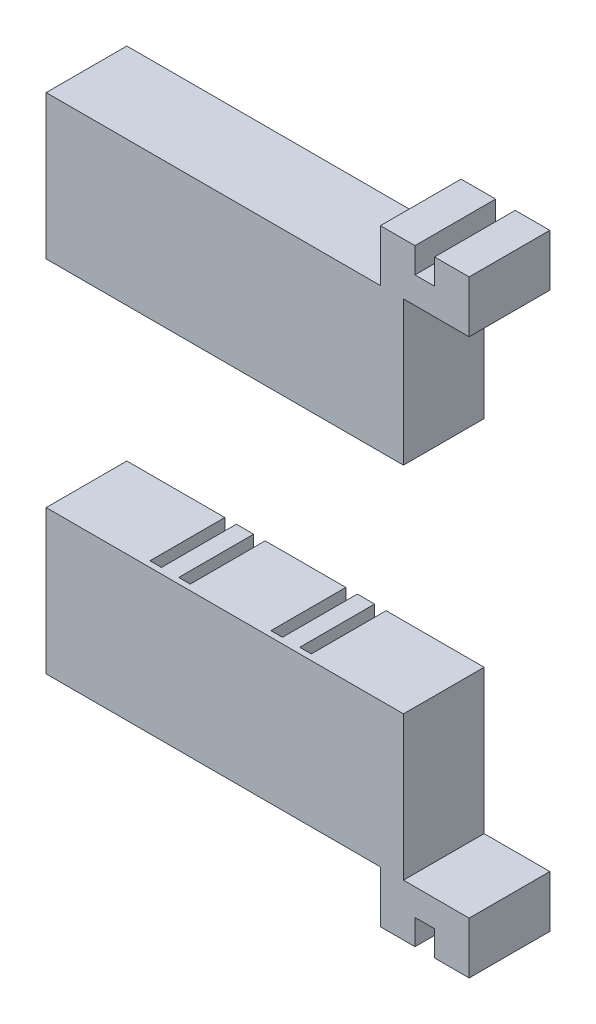
from build123d import *

# Parameters (mm, degrees)
BOSS_EXTRUDE1_DEPTH   = 13
BOSS_EXTRUDE1_2_DEPTH = 13
BOSS_EXTRUDE1_3_DEPTH = 13
BOSS_EXTRUDE1_4_DEPTH = 13
BOSS_EXTRUDE1_5_DEPTH = 13
BOSS_EXTRUDE1_6_DEPTH = 13
BOSS_EXTRUDE3_DEPTH   = 1
CUT_EXTRUDE1_DEPTH    = 1
CUT_EXTRUDE2_DEPTH    = 1


with BuildPart() as part:
    # Sketch1 → Boss-Extrude1 (new body)
    with BuildSketch(Plane.XY):
        with BuildLine():
            Line((0, 0), (58, 0))
            Line((58, 0), (58, 9))
            Line((58, 9), (64, 9))
            Line((64, 9), (64, 4.6))
            Line((64, 4.6), (67.4, 4.6))
            Line((67.4, 4.6), (67.4, 9))
            Line((67.4, 9), (73.4, 9))
            Line((73.4, 9), (73.4, 0))
            Line((73.4, 0), (62, 0))
            Line((62, 0), (62, -25))
            Line((62, -25), (45, -25))
            Line((45, -25), (45, -20))
            ThreePointArc((45, -20), (45.585786438, -18.585786438), (47, -18))
            Line((47, -18), (50, -18))
            ThreePointArc((50, -18), (51.414213562, -17.414213562), (52, -16))
            Line((52, -16), (52, -12))
            ThreePointArc((52, -12), (51.414213562, -10.585786438), (50, -10))
            Line((50, -10), (40, -10))
            ThreePointArc((40, -10), (38.585786438, -10.585786438), (38, -12))
            Line((38, -12), (38, -25))
            Line((38, -25), (24, -25))
            Line((24, -25), (24, -12))
            ThreePointArc((24, -12), (23.414213562, -10.585786438), (22, -10))
            Line((22, -10), (12, -10))
            ThreePointArc((12, -10), (10.585786438, -10.585786438), (10, -12))
            Line((10, -12), (10, -16))
            ThreePointArc((10, -16), (10.585786438, -17.414213562), (12, -18))
            Line((12, -18), (15, -18))
            ThreePointArc((15, -18), (16.414213562, -18.585786438), (17, -20))
            Line((17, -20), (17, -25))
            Line((17, -25), (0, -25))
            Line((0, -25), (0, 0))
        make_face()
    extrude(amount=BOSS_EXTRUDE1_DEPTH)



with BuildPart() as body_2:
    # Sketch1 → Boss-Extrude1 2 (new body)
    with BuildSketch(Plane.XY):
        with BuildLine():
            Line((40, -25), (40, -13))
            ThreePointArc((40, -13), (40.292893219, -12.292893219), (41, -12))
            Line((41, -12), (49, -12))
            ThreePointArc((49, -12), (49.707106781, -12.292893219), (50, -13))
            Line((50, -13), (50, -15))
            ThreePointArc((50, -15), (49.707106781, -15.707106781), (49, -16))
            Line((49, -16), (47, -16))
            ThreePointArc((47, -16), (44.171572875, -17.171572875), (43, -20))
            Line((43, -20), (43, -25))
            Line((43, -25), (40, -25))
        make_face()
    extrude(amount=BOSS_EXTRUDE1_2_DEPTH)


with BuildPart() as body_3:
    # Sketch1 → Boss-Extrude1 3 (new body)
    with BuildSketch(Plane.XY):
        with BuildLine():
            Line((22, -13), (22, -25))
            Line((22, -25), (19, -25))
            Line((19, -25), (19, -20))
            ThreePointArc((19, -20), (17.828427125, -17.171572875), (15, -16))
            Line((15, -16), (13, -16))
            ThreePointArc((13, -16), (12.292893219, -15.707106781), (12, -15))
            Line((12, -15), (12, -13))
            ThreePointArc((12, -13), (12.292893219, -12.292893219), (13, -12))
            Line((13, -12), (21, -12))
            ThreePointArc((21, -12), (21.707106781, -12.292893219), (22, -13))
        make_face()
    extrude(amount=BOSS_EXTRUDE1_3_DEPTH)


with BuildPart() as body_4:
    # Sketch1 → Boss-Extrude1 4 (new body)
    with BuildSketch(Plane.XY):
        with BuildLine():
            Line((0, -87.365039028), (58, -87.365039028))
            Line((58, -87.365039028), (58, -96.365039028))
            Line((58, -96.365039028), (64, -96.365039028))
            Line((64, -96.365039028), (64, -91.965039028))
            Line((64, -91.965039028), (67.4, -91.965039028))
            Line((67.4, -91.965039028), (67.4, -96.365039028))
            Line((67.4, -96.365039028), (73.4, -96.365039028))
            Line((73.4, -96.365039028), (73.4, -87.365039028))
            Line((73.4, -87.365039028), (62, -87.365039028))
            Line((62, -87.365039028), (62, -62.365039028))
            Line((62, -62.365039028), (45, -62.365039028))
            Line((45, -62.365039028), (45, -67.365039028))
            ThreePointArc((45, -67.365039028), (45.585786438, -68.779252591), (47, -69.365039028))
            Line((47, -69.365039028), (50, -69.365039028))
            ThreePointArc((50, -69.365039028), (51.414213562, -69.950825466), (52, -71.365039028))
            Line((52, -71.365039028), (52, -75.365039028))
            ThreePointArc((52, -75.365039028), (51.414213562, -76.779252591), (50, -77.365039028))
            Line((50, -77.365039028), (40, -77.365039028))
            ThreePointArc((40, -77.365039028), (38.585786438, -76.779252591), (38, -75.365039028))
            Line((38, -75.365039028), (38, -62.365039028))
            Line((38, -62.365039028), (24, -62.365039028))
            Line((24, -62.365039028), (24, -75.365039028))
            ThreePointArc((24, -75.365039028), (23.414213562, -76.779252591), (22, -77.365039028))
            Line((22, -77.365039028), (12, -77.365039028))
            ThreePointArc((12, -77.365039028), (10.585786438, -76.779252591), (10, -75.365039028))
            Line((10, -75.365039028), (10, -71.365039028))
            ThreePointArc((10, -71.365039028), (10.585786438, -69.950825466), (12, -69.365039028))
            Line((12, -69.365039028), (15, -69.365039028))
            ThreePointArc((15, -69.365039028), (16.414213562, -68.779252591), (17, -67.365039028))
            Line((17, -67.365039028), (17, -62.365039028))
            Line((17, -62.365039028), (0, -62.365039028))
            Line((0, -62.365039028), (0, -87.365039028))
        make_face()
    extrude(amount=BOSS_EXTRUDE1_4_DEPTH)


with BuildPart() as body_5:
    # Sketch1 → Boss-Extrude1 5 (new body)
    with BuildSketch(Plane.XY):
        with BuildLine():
            Line((22, -62.365039028), (22, -74.365039028))
            ThreePointArc((22, -74.365039028), (21.707106781, -75.07214581), (21, -75.365039028))
            Line((21, -75.365039028), (13, -75.365039028))
            ThreePointArc((13, -75.365039028), (12.292893219, -75.07214581), (12, -74.365039028))
            Line((12, -74.365039028), (12, -72.365039028))
            ThreePointArc((12, -72.365039028), (12.292893219, -71.657932247), (13, -71.365039028))
            Line((13, -71.365039028), (15, -71.365039028))
            ThreePointArc((15, -71.365039028), (17.828427125, -70.193466153), (19, -67.365039028))
            Line((19, -67.365039028), (19, -62.365039028))
            Line((19, -62.365039028), (22, -62.365039028))
        make_face()
    extrude(amount=BOSS_EXTRUDE1_5_DEPTH)


with BuildPart() as body_6:
    # Sketch1 → Boss-Extrude1 6 (new body)
    with BuildSketch(Plane.XY):
        with BuildLine():
            Line((40, -62.365039028), (40, -74.365039028))
            ThreePointArc((40, -74.365039028), (40.292893219, -75.07214581), (41, -75.365039028))
            Line((41, -75.365039028), (49, -75.365039028))
            ThreePointArc((49, -75.365039028), (49.707106781, -75.07214581), (50, -74.365039028))
            Line((50, -74.365039028), (50, -72.365039028))
            ThreePointArc((50, -72.365039028), (49.707106781, -71.657932247), (49, -71.365039028))
            Line((49, -71.365039028), (47, -71.365039028))
            ThreePointArc((47, -71.365039028), (44.171572875, -70.193466153), (43, -67.365039028))
            Line((43, -67.365039028), (43, -62.365039028))
            Line((43, -62.365039028), (40, -62.365039028))
        make_face()
    extrude(amount=BOSS_EXTRUDE1_6_DEPTH)


with BuildPart() as part_1:
    add(part.part)

    add(body_2.part)  # Boss-Extrude3 merges body 2

    add(body_3.part)  # Boss-Extrude3 merges body 3

    add(body_4.part)  # Boss-Extrude3 merges body 4

    add(body_5.part)  # Boss-Extrude3 merges body 5

    add(body_6.part)  # Boss-Extrude3 merges body 6
    # Sketch7 → Boss-Extrude3 (add)
    with BuildSketch(Plane.XY.offset(13)):
        Polygon((0, 0), (58, 0), (58, 9), (64, 9), (64, 4.6), (67.4, 4.6), (67.4, 9), (73.4, 9), (73.4, 0), (62, 0), (62, -25), (0, -25), align=None)
        Polygon((0, -62.365039028), (62, -62.365039028), (62, -87.365039028), (73.4, -87.365039028), (73.4, -96.365039028), (67.4, -96.365039028), (67.4, -91.965039028), (64, -91.965039028), (64, -96.365039028), (58, -96.365039028), (58, -87.365039028), (0, -87.365039028), align=None)
    extrude(amount=BOSS_EXTRUDE3_DEPTH)

    # Sketch9 → Cut-Extrude1 (cut)
    # profile 1 of 2: a face of its own
    with BuildSketch(Plane.ZY.offset(-58)):
        with BuildLine():
            Line((9.295221595, 7.455014322), (8.981119031, 7.455014322))
            add(Edge.make_bspline(
                [(8.981119031, 7.455014322), (8.983166184, 7.49668521), (8.987186738, 7.578525724), (9.006015027, 7.697849631), (9.032955905, 7.81190443), (9.071047359, 7.919774343), (9.118353636, 8.022413151), (9.175083664, 8.119413166), (9.242277514, 8.210404355), (9.318484248, 8.294543198), (9.401252887, 8.371730769), (9.490558827, 8.438386012), (9.584403854, 8.494703683), (9.682503253, 8.541784925), (9.785963817, 8.577124771), (9.893846675, 8.603346411), (10.006625811, 8.619122756), (10.083465833, 8.620818542), (10.122545313, 8.621680989)],
                knots=[0, 0, 0, 0, 1.10065271, 2.161652631, 3.183658789, 4.190468796, 5.17591951, 6.163126047, 7.15150782, 8.156236427, 9.156009102, 10.134482811, 11.092018607, 12.041330605, 13.001268258, 13.972401359, 14.968799086, 16, 16, 16, 16], degree=3))
            add(Edge.make_bspline(
                [(10.122545313, 8.621680989), (10.160923387, 8.620782532), (10.236334932, 8.619017097), (10.346396946, 8.603856068), (10.451174241, 8.580110477), (10.550462007, 8.54679506), (10.643468072, 8.502010633), (10.730891117, 8.448213094), (10.813771927, 8.385993263), (10.888378711, 8.312739449), (10.95688679, 8.234537065), (11.015989045, 8.151049161), (11.066602209, 8.064819876), (11.108789889, 7.975191674), (11.139846028, 7.881320646), (11.163424236, 7.784573443), (11.176751649, 7.683948632), (11.178797073, 7.615842076), (11.17983698, 7.581216245)],
                knots=[0, 0, 0, 0, 1.111607364, 2.184268762, 3.212621178, 4.221274766, 5.211760367, 6.196651075, 7.1921475, 8.207485113, 9.220403448, 10.201281604, 11.166441695, 12.114753415, 13.065576456, 14.026450734, 14.996634279, 16, 16, 16, 16], degree=3))
            add(Edge.make_bspline(
                [(11.17983698, 7.581216245), (11.178143717, 7.532468411), (11.174786906, 7.435828197), (11.146072529, 7.293813334), (11.101226018, 7.156219915), (11.047228661, 7.045482613), (10.992756217, 6.956249119), (10.94366871, 6.882780414), (10.886203898, 6.803674946), (10.819525401, 6.719197609), (10.745012528, 6.628686703), (10.661990365, 6.532196908), (10.569866883, 6.430725138), (10.505208382, 6.361419537), (10.471703967, 6.325507111)],
                knots=[0, 0, 0, 0, 1.184426356, 2.348067706, 3.509069118, 4.696110526, 5.333549288, 6.050745305, 6.844228056, 7.710549037, 8.667450064, 9.695053472, 10.805634456, 12, 12, 12, 12], degree=3))
            Line((10.471703967, 6.325507111), (9.596002845, 5.390911758))
            Line((9.596002845, 5.390911758), (11.224708775, 5.390911758))
            Line((11.224708775, 5.390911758), (11.224708775, 5.031937399))
            Line((11.224708775, 5.031937399), (8.846503647, 5.031937399))
            Line((8.846503647, 5.031937399), (10.203875441, 6.480455027))
            add(Edge.make_bspline(
                [(10.203875441, 6.480455027), (10.236923328, 6.514953334), (10.300401555, 6.58121752), (10.390184132, 6.67796048), (10.47082312, 6.767710021), (10.542840513, 6.85029657), (10.604674019, 6.926928137), (10.659546251, 6.995122841), (10.703511842, 7.057877291), (10.751227237, 7.130617905), (10.797441219, 7.219430222), (10.837153575, 7.327963912), (10.861368423, 7.439691164), (10.864273259, 7.515193201), (10.865734416, 7.553171373)],
                knots=[0, 0, 0, 0, 1.329631726, 2.553950428, 3.673215718, 4.687767853, 5.603093632, 6.413772471, 7.123043292, 7.734684054, 8.834405432, 9.900288307, 10.943827018, 12, 12, 12, 12], degree=3))
            add(Edge.make_bspline(
                [(10.865734416, 7.553171373), (10.865098673, 7.577052772), (10.863845747, 7.624118422), (10.85278805, 7.693124181), (10.836077544, 7.759688995), (10.812132286, 7.824017614), (10.780525546, 7.885463266), (10.742052166, 7.944100746), (10.697662102, 8.000789712), (10.646310833, 8.05394301), (10.589899313, 8.102624215), (10.530305064, 8.1457483), (10.467254959, 8.181787411), (10.401014837, 8.211330908), (10.331769368, 8.23450629), (10.259384623, 8.250564869), (10.184060606, 8.260647353), (10.132627111, 8.262011525), (10.106419512, 8.26270663)],
                knots=[0, 0, 0, 0, 0.991446411, 1.95395049, 2.89581595, 3.838931463, 4.798493298, 5.75982156, 6.748411868, 7.785213223, 8.824556874, 9.840280684, 10.836137867, 11.835679398, 12.848801643, 13.863922112, 14.911575587, 16, 16, 16, 16], degree=3))
            add(Edge.make_bspline(
                [(10.106419512, 8.26270663), (10.079048679, 8.261991597), (10.025296883, 8.260587392), (9.94637785, 8.250764728), (9.871092073, 8.233818888), (9.79925017, 8.210642213), (9.730730584, 8.181183665), (9.66586654, 8.14449192), (9.60480365, 8.100708427), (9.547427127, 8.05106787), (9.494563148, 7.995800269), (9.448116272, 7.934190306), (9.407532258, 7.867362891), (9.372123025, 7.79549834), (9.343367334, 7.71794456), (9.321394184, 7.634976855), (9.304007337, 7.546955474), (9.298198817, 7.486170389), (9.295221595, 7.455014322)],
                knots=[0, 0, 0, 0, 1.031018746, 2.02475058, 2.990194455, 3.934040569, 4.864654155, 5.795059489, 6.735614925, 7.690564532, 8.649604399, 9.611025574, 10.590972636, 11.591080095, 12.624614302, 13.701020113, 14.821632451, 16, 16, 16, 16], degree=3))
        make_face()
    # profile 2 of 2: a face of its own
    with BuildSketch(Plane.ZY.offset(-58)):
        with BuildLine():
            Line((12.301631852, 4.942193809), (12.050630249, 5.116773136))
            Line((12.050630249, 5.116773136), (13.0237873, 6.539349258))
            add(Edge.make_bspline(
                [(13.0237873, 6.539349258), (12.961696565, 6.531756195), (12.839436445, 6.51680503), (12.716299343, 6.514058375), (12.655698358, 6.51270663)],
                knots=[0, 0, 0, 0, 1.015715272, 2, 2, 2, 2], degree=3))
            add(Edge.make_bspline(
                [(12.655698358, 6.51270663), (12.61895631, 6.513647706), (12.546834883, 6.515494957), (12.440803231, 6.530136765), (12.33891767, 6.552686893), (12.241448314, 6.586335648), (12.14802881, 6.628153857), (12.058863096, 6.680010871), (11.974071206, 6.741017162), (11.894563796, 6.810850154), (11.822252057, 6.887528206), (11.757828759, 6.968683849), (11.704287627, 7.05525982), (11.659811042, 7.14549004), (11.626080588, 7.24067139), (11.601518051, 7.339720791), (11.586395696, 7.443332432), (11.584596601, 7.513857563), (11.583683134, 7.549665764)],
                knots=[0, 0, 0, 0, 1.060718605, 2.082097864, 3.085795603, 4.069760067, 5.054557537, 6.03741023, 7.043284206, 8.066802108, 9.088538119, 10.083643548, 11.053783639, 12.022749082, 12.983451788, 13.964007469, 14.966251758, 16, 16, 16, 16], degree=3))
            add(Edge.make_bspline(
                [(11.583683134, 7.549665764), (11.585417569, 7.598634417), (11.588821912, 7.694749949), (11.616220429, 7.835183718), (11.661280769, 7.967970261), (11.724109145, 8.092760455), (11.803243867, 8.207759194), (11.898352457, 8.311367804), (12.008856421, 8.402112657), (12.13223844, 8.480116735), (12.265591461, 8.542851732), (12.405260119, 8.589091033), (12.550174239, 8.61628978), (12.648341909, 8.619875642), (12.697765666, 8.621680989)],
                knots=[0, 0, 0, 0, 1.022988612, 2.007919123, 2.978103895, 3.94594894, 4.918897164, 5.887013414, 6.875921846, 7.89917871, 8.930658928, 9.948724884, 10.967259574, 12, 12, 12, 12], degree=3))
            add(Edge.make_bspline(
                [(12.697765666, 8.621680989), (12.746254085, 8.619850826), (12.842062632, 8.616234596), (12.982951639, 8.589750627), (13.117892656, 8.545113954), (13.246137642, 8.48342939), (13.364877055, 8.406108483), (13.471652866, 8.313973959), (13.564028405, 8.206968432), (13.641852286, 8.087679942), (13.704322326, 7.95951296), (13.749394609, 7.825729038), (13.777140248, 7.687290317), (13.780636575, 7.593495843), (13.782401082, 7.546160155)],
                knots=[0, 0, 0, 0, 1.026385292, 2.028040595, 3.023318987, 4.028184125, 5.03290303, 6.015178782, 7.004435299, 8.016004309, 9.023023918, 10.015172535, 10.998308025, 12, 12, 12, 12], degree=3))
            add(Edge.make_bspline(
                [(13.782401082, 7.546160155), (13.781222674, 7.509416388), (13.778832566, 7.434890848), (13.762096259, 7.321660505), (13.733676073, 7.206209275), (13.701424375, 7.10848768), (13.670292207, 7.02777923), (13.640991075, 6.96402765), (13.608478922, 6.896926386), (13.570560156, 6.827179049), (13.52979786, 6.753896514), (13.483738583, 6.677813798), (13.433433011, 6.598828805), (13.397603292, 6.545581717), (13.37925605, 6.518315604)],
                knots=[0, 0, 0, 0, 1.179839688, 2.393009684, 3.667231171, 4.993948276, 5.694988576, 6.444077775, 7.246288328, 8.089075292, 8.993003841, 9.939041771, 10.944649915, 12, 12, 12, 12], degree=3))
            Line((13.37925605, 6.518315604), (12.301631852, 4.942193809))
        make_face()
        with BuildLine():
            add(Edge.make_bspline(
                [(12.713891467, 6.871680989), (12.741725481, 6.872441372), (12.795908844, 6.873921581), (12.875286143, 6.882930823), (12.950210347, 6.898904809), (13.020881596, 6.921824521), (13.088008498, 6.94948119), (13.150524826, 6.984693176), (13.208482901, 7.026709811), (13.262270828, 7.073919827), (13.310034828, 7.12637041), (13.352577859, 7.181267517), (13.388738426, 7.238852127), (13.417301703, 7.299845389), (13.440786279, 7.362762598), (13.457004291, 7.428616953), (13.465988624, 7.497065354), (13.467520199, 7.543564012), (13.468298518, 7.567193809)],
                knots=[0, 0, 0, 0, 1.163407946, 2.26475976, 3.333800367, 4.359385343, 5.366239384, 6.363380779, 7.350133999, 8.353570782, 9.349036268, 10.310270964, 11.253520213, 12.184142, 13.120487599, 14.056272588, 15.012232024, 16, 16, 16, 16], degree=3))
            add(Edge.make_bspline(
                [(13.468298518, 7.567193809), (13.467628849, 7.590833474), (13.466309184, 7.637418334), (13.455721884, 7.705968074), (13.437096661, 7.771661335), (13.412106176, 7.834857765), (13.379185939, 7.895038137), (13.339682453, 7.952958009), (13.292750003, 8.008250137), (13.238747437, 8.05961412), (13.180512884, 8.106962019), (13.118452384, 8.148748095), (13.053077468, 8.183769292), (12.984786978, 8.212668262), (12.913438629, 8.235220037), (12.839074641, 8.251437402), (12.761319235, 8.260409156), (12.708537949, 8.261931051), (12.681639865, 8.26270663)],
                knots=[0, 0, 0, 0, 0.972161553, 1.915763587, 2.844109794, 3.775983486, 4.705125789, 5.659731448, 6.655561913, 7.682237399, 8.721216875, 9.739758359, 10.754845918, 11.767244016, 12.7857855, 13.828538656, 14.893392813, 16, 16, 16, 16], degree=3))
            add(Edge.make_bspline(
                [(12.681639865, 8.26270663), (12.654975711, 8.261929798), (12.602660862, 8.260405661), (12.525596702, 8.251454456), (12.451735535, 8.235110971), (12.380593914, 8.212678708), (12.312305454, 8.183767136), (12.246933621, 8.14874626), (12.184858604, 8.106971638), (12.126679883, 8.059576866), (12.072581961, 8.008489219), (12.026456432, 7.952715791), (11.98686254, 7.895068266), (11.953987537, 7.834849758), (11.92898502, 7.771663472), (11.910363019, 7.705967495), (11.899774853, 7.637418485), (11.898455307, 7.590833525), (11.897785698, 7.567193809)],
                knots=[0, 0, 0, 0, 1.099389452, 2.15699305, 3.192601482, 4.213358962, 5.227959689, 6.245255729, 7.266013209, 8.307253147, 9.336162325, 10.327954924, 11.284637477, 12.215801273, 13.149702402, 14.080068371, 15.025723358, 16, 16, 16, 16], degree=3))
            add(Edge.make_bspline(
                [(11.897785698, 7.567193809), (11.898391624, 7.54354561), (11.899586621, 7.496907034), (11.911114411, 7.428380641), (11.930392691, 7.362692447), (11.956212081, 7.29920374), (11.990213671, 7.238531882), (12.031937519, 7.18096452), (12.080843065, 7.12584907), (12.136276553, 7.074041858), (12.196944714, 7.026489683), (12.26174146, 6.984959301), (12.329551297, 6.949886856), (12.400612928, 6.921745472), (12.474399728, 6.899133809), (12.551574859, 6.882960264), (12.631883097, 6.874007997), (12.686293078, 6.8724641), (12.713891467, 6.871680989)],
                knots=[0, 0, 0, 0, 0.952633368, 1.87876736, 2.791047057, 3.707742249, 4.635551637, 5.587206343, 6.568248508, 7.601284464, 8.641511608, 9.671105535, 10.699146789, 11.713763218, 12.747829548, 13.806491675, 14.887386225, 16, 16, 16, 16], degree=3))
        make_face(mode=Mode.SUBTRACT)
    extrude(amount=-CUT_EXTRUDE1_DEPTH, mode=Mode.SUBTRACT)

    # Sketch10 → Cut-Extrude2 (cut)
    # profile 1 of 2: a face of its own
    with BuildSketch(Plane.ZY.offset(-58)):
        with BuildLine():
            Line((8.641654509, -92.691622923), (8.327551945, -92.691622923))
            add(Edge.make_bspline(
                [(8.327551945, -92.691622923), (8.329599098, -92.649952035), (8.333619652, -92.568111521), (8.352447941, -92.448787614), (8.379388818, -92.334732816), (8.417480272, -92.226862902), (8.46478655, -92.124224094), (8.521516577, -92.027224079), (8.588710428, -91.93623289), (8.664917162, -91.852094047), (8.747685801, -91.774906476), (8.83699174, -91.708251233), (8.930836768, -91.651933562), (9.028936167, -91.60485232), (9.13239673, -91.569512474), (9.240279588, -91.543290834), (9.353058724, -91.527514489), (9.429898747, -91.525818703), (9.468978227, -91.524956256)],
                knots=[0, 0, 0, 0, 1.10065271, 2.161652631, 3.183658789, 4.190468796, 5.17591951, 6.163126047, 7.15150782, 8.156236427, 9.156009102, 10.134482811, 11.092018607, 12.041330605, 13.001268258, 13.972401359, 14.968799086, 16, 16, 16, 16], degree=3))
            add(Edge.make_bspline(
                [(9.468978227, -91.524956256), (9.507356301, -91.525854713), (9.582767845, -91.527620148), (9.69282986, -91.542781177), (9.797607154, -91.566526769), (9.896894921, -91.599842185), (9.989900985, -91.644626612), (10.07732403, -91.698424151), (10.160204841, -91.760643982), (10.234811624, -91.833897796), (10.303319704, -91.91210018), (10.362421959, -91.995588084), (10.413035122, -92.08181737), (10.455222802, -92.171445571), (10.486278941, -92.2653166), (10.509857149, -92.362063802), (10.523184563, -92.462688613), (10.525229986, -92.530795169), (10.526269893, -92.565421)],
                knots=[0, 0, 0, 0, 1.111607364, 2.184268762, 3.212621178, 4.221274766, 5.211760367, 6.196651075, 7.1921475, 8.207485113, 9.220403448, 10.201281604, 11.166441695, 12.114753415, 13.065576456, 14.026450734, 14.996634279, 16, 16, 16, 16], degree=3))
            add(Edge.make_bspline(
                [(10.526269893, -92.565421), (10.524576631, -92.614168835), (10.521219819, -92.710809048), (10.492505443, -92.852823911), (10.447658932, -92.99041733), (10.393661575, -93.101154632), (10.339189131, -93.190388126), (10.290101623, -93.263856831), (10.232636812, -93.342962299), (10.165958314, -93.427439637), (10.091445442, -93.517950542), (10.008423279, -93.614440337), (9.916299797, -93.715912107), (9.851641296, -93.785217708), (9.818136881, -93.821130135)],
                knots=[0, 0, 0, 0, 1.184426356, 2.348067706, 3.509069118, 4.696110526, 5.333549288, 6.050745305, 6.844228056, 7.710549037, 8.667450064, 9.695053472, 10.805634456, 12, 12, 12, 12], degree=3))
            Line((9.818136881, -93.821130135), (8.942435759, -94.755725487))
            Line((8.942435759, -94.755725487), (10.571141688, -94.755725487))
            Line((10.571141688, -94.755725487), (10.571141688, -95.114699846))
            Line((10.571141688, -95.114699846), (8.19293656, -95.114699846))
            Line((8.19293656, -95.114699846), (9.550308355, -93.666182218))
            add(Edge.make_bspline(
                [(9.550308355, -93.666182218), (9.583356242, -93.631683911), (9.646834469, -93.565419725), (9.736617046, -93.468676765), (9.817256034, -93.378927224), (9.889273427, -93.296340675), (9.951106932, -93.219709108), (10.005979164, -93.151514404), (10.049944755, -93.088759954), (10.097660151, -93.01601934), (10.143874132, -92.927207023), (10.183586488, -92.818673333), (10.207801337, -92.706946081), (10.210706172, -92.631444044), (10.212167329, -92.593465872)],
                knots=[0, 0, 0, 0, 1.329631726, 2.553950428, 3.673215718, 4.687767853, 5.603093632, 6.413772471, 7.123043292, 7.734684054, 8.834405432, 9.900288307, 10.943827018, 12, 12, 12, 12], degree=3))
            add(Edge.make_bspline(
                [(10.212167329, -92.593465872), (10.211531587, -92.569584473), (10.210278661, -92.522518823), (10.199220964, -92.453513064), (10.182510457, -92.38694825), (10.158565199, -92.322619631), (10.126958459, -92.261173979), (10.088485079, -92.202536499), (10.044095016, -92.145847534), (9.992743747, -92.092694235), (9.936332227, -92.04401303), (9.876737977, -92.000888945), (9.813687873, -91.964849834), (9.747447751, -91.935306337), (9.678202281, -91.912130955), (9.605817536, -91.896072376), (9.53049352, -91.885989892), (9.479060024, -91.88462572), (9.452852425, -91.883930615)],
                knots=[0, 0, 0, 0, 0.991446411, 1.95395049, 2.89581595, 3.838931463, 4.798493298, 5.75982156, 6.748411868, 7.785213223, 8.824556874, 9.840280684, 10.836137867, 11.835679398, 12.848801643, 13.863922112, 14.911575587, 16, 16, 16, 16], degree=3))
            add(Edge.make_bspline(
                [(9.452852425, -91.883930615), (9.425481593, -91.884645648), (9.371729796, -91.886049853), (9.292810764, -91.895872517), (9.217524986, -91.912818357), (9.145683083, -91.935995032), (9.077163497, -91.96545358), (9.012299453, -92.002145325), (8.951236564, -92.045928818), (8.893860041, -92.095569375), (8.840996062, -92.150836976), (8.794549186, -92.212446939), (8.753965172, -92.279274354), (8.718555938, -92.351138905), (8.689800248, -92.428692685), (8.667827098, -92.51166039), (8.650440251, -92.599681771), (8.64463173, -92.660466856), (8.641654509, -92.691622923)],
                knots=[0, 0, 0, 0, 1.031018746, 2.02475058, 2.990194455, 3.934040569, 4.864654155, 5.795059489, 6.735614925, 7.690564532, 8.649604399, 9.611025574, 10.590972636, 11.591080095, 12.624614302, 13.701020113, 14.821632451, 16, 16, 16, 16], degree=3))
        make_face()
    # profile 2 of 2: a face of its own
    with BuildSketch(Plane.ZY.offset(-58)):
        with BuildLine():
            Line((11.648064765, -95.204443436), (11.397063163, -95.029864109))
            Line((11.397063163, -95.029864109), (12.370220214, -93.607287987))
            add(Edge.make_bspline(
                [(12.370220214, -93.607287987), (12.308129478, -93.61488105), (12.185869358, -93.629832215), (12.062732256, -93.63257887), (12.002131272, -93.633930615)],
                knots=[0, 0, 0, 0, 1.015715272, 2, 2, 2, 2], degree=3))
            add(Edge.make_bspline(
                [(12.002131272, -93.633930615), (11.965389224, -93.632989539), (11.893267797, -93.631142288), (11.787236144, -93.61650048), (11.685350584, -93.593950352), (11.587881228, -93.560301597), (11.494461723, -93.518483388), (11.40529601, -93.466626374), (11.320504119, -93.405620083), (11.240996709, -93.335787091), (11.16868497, -93.259109039), (11.104261673, -93.177953396), (11.050720541, -93.091377425), (11.006243955, -93.001147206), (10.972513502, -92.905965855), (10.947950964, -92.806916455), (10.93282861, -92.703304813), (10.931029514, -92.632779682), (10.930116047, -92.596971481)],
                knots=[0, 0, 0, 0, 1.060718605, 2.082097864, 3.085795603, 4.069760067, 5.054557537, 6.03741023, 7.043284206, 8.066802108, 9.088538119, 10.083643548, 11.053783639, 12.022749082, 12.983451788, 13.964007469, 14.966251758, 16, 16, 16, 16], degree=3))
            add(Edge.make_bspline(
                [(10.930116047, -92.596971481), (10.931850482, -92.548002828), (10.935254826, -92.451887296), (10.962653343, -92.311453527), (11.007713682, -92.178666984), (11.070542059, -92.05387679), (11.14967678, -91.938878051), (11.24478537, -91.835269442), (11.355289335, -91.744524588), (11.478671354, -91.66652051), (11.612024375, -91.603785513), (11.751693033, -91.557546213), (11.896607153, -91.530347465), (11.994774823, -91.526761604), (12.044198579, -91.524956256)],
                knots=[0, 0, 0, 0, 1.022988612, 2.007919123, 2.978103895, 3.94594894, 4.918897164, 5.887013414, 6.875921846, 7.89917871, 8.930658928, 9.948724884, 10.967259574, 12, 12, 12, 12], degree=3))
            add(Edge.make_bspline(
                [(12.044198579, -91.524956256), (12.092686999, -91.526786419), (12.188495546, -91.530402649), (12.329384552, -91.556886618), (12.464325569, -91.601523291), (12.592570556, -91.663207855), (12.711309968, -91.740528762), (12.818085779, -91.832663286), (12.910461318, -91.939668813), (12.988285199, -92.058957303), (13.050755239, -92.187124285), (13.095827522, -92.320908207), (13.123573161, -92.459346928), (13.127069489, -92.553141403), (13.128833996, -92.60047709)],
                knots=[0, 0, 0, 0, 1.026385292, 2.028040595, 3.023318987, 4.028184125, 5.03290303, 6.015178782, 7.004435299, 8.016004309, 9.023023918, 10.015172535, 10.998308025, 12, 12, 12, 12], degree=3))
            add(Edge.make_bspline(
                [(13.128833996, -92.60047709), (13.127655587, -92.637220857), (13.125265479, -92.711746398), (13.108529172, -92.82497674), (13.080108987, -92.94042797), (13.047857288, -93.038149566), (13.016725121, -93.118858015), (12.987423989, -93.182609595), (12.954911835, -93.249710859), (12.91699307, -93.319458197), (12.876230773, -93.392740732), (12.830171497, -93.468823447), (12.779865925, -93.54780844), (12.744036205, -93.601055528), (12.725688964, -93.628321641)],
                knots=[0, 0, 0, 0, 1.179839688, 2.393009684, 3.667231171, 4.993948276, 5.694988576, 6.444077775, 7.246288328, 8.089075292, 8.993003841, 9.939041771, 10.944649915, 12, 12, 12, 12], degree=3))
            Line((12.725688964, -93.628321641), (11.648064765, -95.204443436))
        make_face()
        with BuildLine():
            add(Edge.make_bspline(
                [(12.060324381, -93.274956256), (12.088158395, -93.274195873), (12.142341758, -93.272715664), (12.221719057, -93.263706422), (12.29664326, -93.247732436), (12.36731451, -93.224812724), (12.434441411, -93.197156055), (12.49695774, -93.161944069), (12.554915815, -93.119927434), (12.608703742, -93.072717418), (12.656467742, -93.020266835), (12.699010772, -92.965369728), (12.73517134, -92.907785118), (12.763734617, -92.846791856), (12.787219192, -92.783874647), (12.803437204, -92.718020292), (12.812421538, -92.649571891), (12.813953113, -92.603073233), (12.814731432, -92.579443436)],
                knots=[0, 0, 0, 0, 1.163407946, 2.26475976, 3.333800367, 4.359385343, 5.366239384, 6.363380779, 7.350133999, 8.353570782, 9.349036268, 10.310270964, 11.253520213, 12.184142, 13.120487599, 14.056272588, 15.012232024, 16, 16, 16, 16], degree=3))
            add(Edge.make_bspline(
                [(12.814731432, -92.579443436), (12.814061763, -92.555803771), (12.812742097, -92.509218911), (12.802154798, -92.440669171), (12.783529575, -92.37497591), (12.75853909, -92.31177948), (12.725618852, -92.251599108), (12.686115366, -92.193679236), (12.639182917, -92.138387109), (12.58518035, -92.087023125), (12.526945797, -92.039675226), (12.464885297, -91.99788915), (12.399510381, -91.962867953), (12.331219891, -91.933968984), (12.259871542, -91.911417208), (12.185507554, -91.895199843), (12.107752149, -91.886228089), (12.054970862, -91.884706194), (12.028072778, -91.883930615)],
                knots=[0, 0, 0, 0, 0.972161553, 1.915763587, 2.844109794, 3.775983486, 4.705125789, 5.659731448, 6.655561913, 7.682237399, 8.721216875, 9.739758359, 10.754845918, 11.767244016, 12.7857855, 13.828538656, 14.893392813, 16, 16, 16, 16], degree=3))
            add(Edge.make_bspline(
                [(12.028072778, -91.883930615), (12.001408625, -91.884707447), (11.949093775, -91.886231584), (11.872029616, -91.89518279), (11.798168448, -91.911526274), (11.727026828, -91.933958538), (11.658738367, -91.962870109), (11.593366534, -91.997890985), (11.531291518, -92.039665607), (11.473112797, -92.08706038), (11.419014875, -92.138148026), (11.372889346, -92.193921455), (11.333295454, -92.251568979), (11.300420451, -92.311787487), (11.275417934, -92.374973773), (11.256795932, -92.44066975), (11.246207767, -92.50921876), (11.24488822, -92.55580372), (11.244218611, -92.579443436)],
                knots=[0, 0, 0, 0, 1.099389452, 2.15699305, 3.192601482, 4.213358962, 5.227959689, 6.245255729, 7.266013209, 8.307253147, 9.336162325, 10.327954924, 11.284637477, 12.215801273, 13.149702402, 14.080068371, 15.025723358, 16, 16, 16, 16], degree=3))
            add(Edge.make_bspline(
                [(11.244218611, -92.579443436), (11.244824537, -92.603091635), (11.246019535, -92.649730211), (11.257547324, -92.718256604), (11.276825604, -92.783944798), (11.302644995, -92.847433505), (11.336646585, -92.908105363), (11.378370433, -92.965672725), (11.427275979, -93.020788175), (11.482709467, -93.072595387), (11.543377628, -93.120147562), (11.608174374, -93.161677944), (11.675984211, -93.196750389), (11.747045841, -93.224891773), (11.820832641, -93.247503436), (11.898007773, -93.263676981), (11.97831601, -93.272629248), (12.032725992, -93.274173145), (12.060324381, -93.274956256)],
                knots=[0, 0, 0, 0, 0.952633368, 1.87876736, 2.791047057, 3.707742249, 4.635551637, 5.587206343, 6.568248508, 7.601284464, 8.641511608, 9.671105535, 10.699146789, 11.713763218, 12.747829548, 13.806491675, 14.887386225, 16, 16, 16, 16], degree=3))
        make_face(mode=Mode.SUBTRACT)
    extrude(amount=-CUT_EXTRUDE2_DEPTH, mode=Mode.SUBTRACT)


solid = part_1.part
